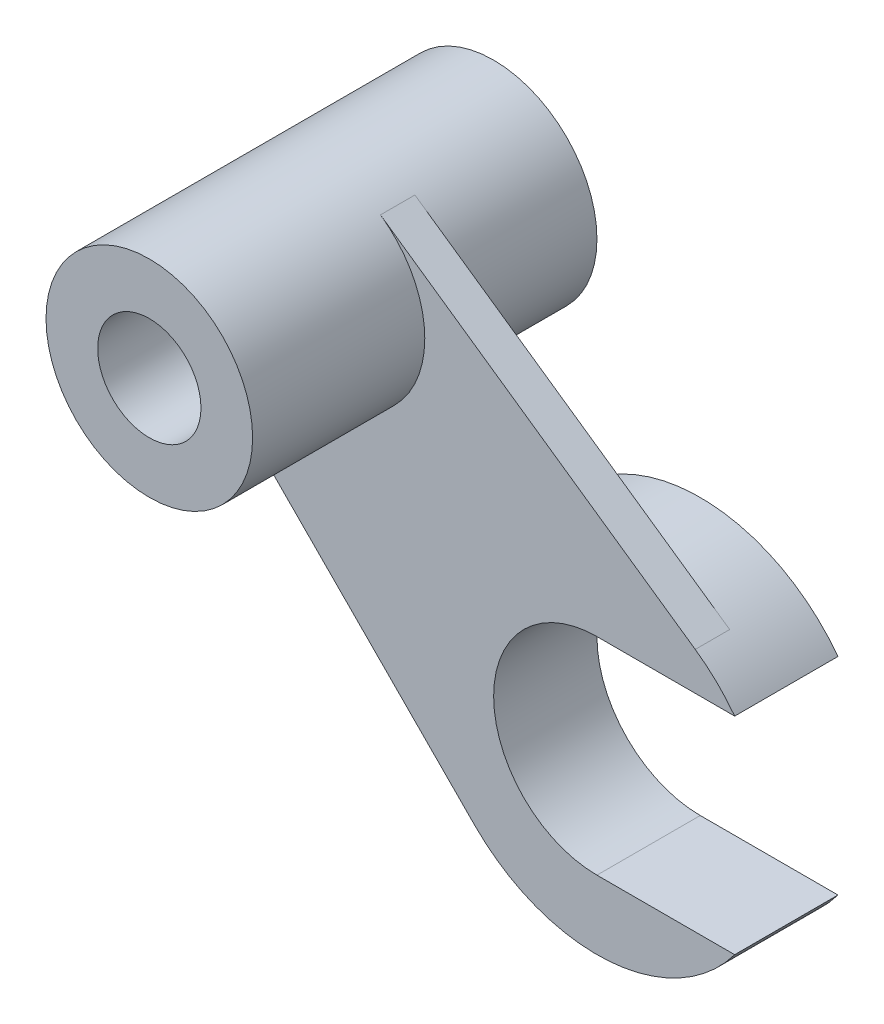
from build123d import *

# Parameters (mm, degrees)
BOSS_EXTRUDE1_DEPTH       = 50
BOSS_EXTRUDE1_DEPTH_BACK  = 50
SKETCH1_R                 = 30
SKETCH3_R                 = 50
BOSS_EXTRUDE2_DEPTH       = 30
BOSS_EXTRUDE3_DEPTH       = 10
F_2_0MM_DOWEL_HOLE1_D     = 30
F_2_0MM_DOWEL_HOLE2_D     = 60
F_2_0MM_DOWEL_HOLE2_DEPTH = 100
SKETCH11_W                = 50.718552078
SKETCH11_H                = 60
CUT_EXTRUDE1_DEPTH        = 40


with BuildPart() as part:
    # Sketch1 → Boss-Extrude1 (new, two sides: drawn at the far end of the back side and taken through both)
    with BuildSketch(Plane.XY.offset(-BOSS_EXTRUDE1_DEPTH_BACK)):
        Circle(SKETCH1_R)
    extrude(amount=BOSS_EXTRUDE1_DEPTH + BOSS_EXTRUDE1_DEPTH_BACK)



with BuildPart() as body_2:
    # Sketch3 → Boss-Extrude2 (new body)
    with BuildSketch(Plane.XY):
        with Locations((80, -80)):
            Circle(SKETCH3_R)
    extrude(amount=-BOSS_EXTRUDE2_DEPTH)


with BuildPart() as part_1:
    add(part.part)

    add(body_2.part)  # Boss-Extrude3 merges body 2
    # Sketch4 → Boss-Extrude3 (add)
    with BuildSketch(Plane.XY):
        Polygon((17.129116361, 24.629116361), (108.548527268, -38.951472732), (44.477364607, -115.187247331), (-30, -40), (-30, 0), align=None)
    extrude(amount=-BOSS_EXTRUDE3_DEPTH)

    # Ø2.0mm Dowel Hole1 (through all)
    with Locations(Plane.XY.offset(50)):
        with Locations((0, 0)):
            Hole(F_2_0MM_DOWEL_HOLE1_D / 2)

    # Ø2.0mm Dowel Hole2
    with Locations(Plane.XY):
        with Locations((80, -80)):
            Hole(F_2_0MM_DOWEL_HOLE2_D / 2, depth=F_2_0MM_DOWEL_HOLE2_DEPTH)

    # Sketch11 → Cut-Extrude1 (cut)
    with BuildSketch(Plane(origin=(0, 0, -30), x_dir=(-1, 0, 0), z_dir=(0, 0, -1))):
        with Locations((-105.359276039, -80)):
            Rectangle(SKETCH11_W, SKETCH11_H)
    extrude(amount=-CUT_EXTRUDE1_DEPTH, mode=Mode.SUBTRACT)


solid = part_1.part
